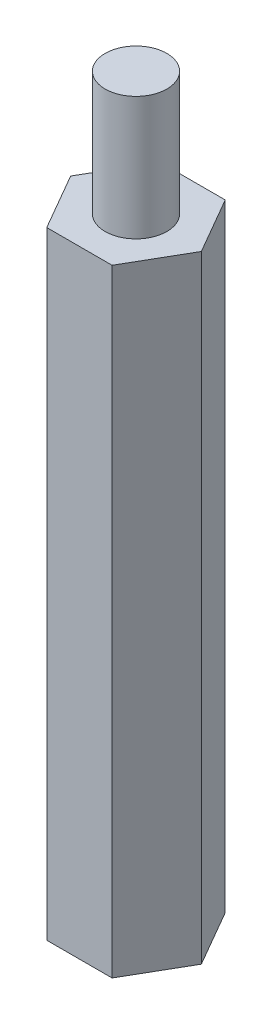
from build123d import *

# Parameters (mm, degrees)
BOSS_EXTRUDE1_DEPTH = 30
SKETCH2_R           = 1.5
CUT_EXTRUDE1_DEPTH  = 6
BOSS_EXTRUDE2_START = -30
SKETCH2_2_R         = 1.5
BOSS_EXTRUDE2_DEPTH = 6


with BuildPart() as part:
    # Sketch1 → Boss-Extrude1 (new body)
    with BuildSketch(Plane(origin=(0, 0, 0), x_dir=(1, 0, 0), z_dir=(0, 1, 0))):
        Polygon((1.58771324, -2.75), (3.175426481, 0), (1.58771324, 2.75), (-1.58771324, 2.75), (-3.175426481, 0), (-1.58771324, -2.75), align=None)
    extrude(amount=BOSS_EXTRUDE1_DEPTH)

    # Sketch2 → Cut-Extrude1 (cut)
    with BuildSketch(Plane.XZ):
        with Locations(Location((0, 0, 0), (0, 0, 270))):
            Circle(SKETCH2_R)
    extrude(amount=-CUT_EXTRUDE1_DEPTH, mode=Mode.SUBTRACT)

    # Sketch2<2> → Boss-Extrude2 (add)
    with BuildSketch(Plane.XZ.offset(BOSS_EXTRUDE2_START)):
        with Locations(Location((0, 0, 0), (0, 0, 270))):
            Circle(SKETCH2_2_R)
    extrude(amount=-BOSS_EXTRUDE2_DEPTH)


solid = part.part
